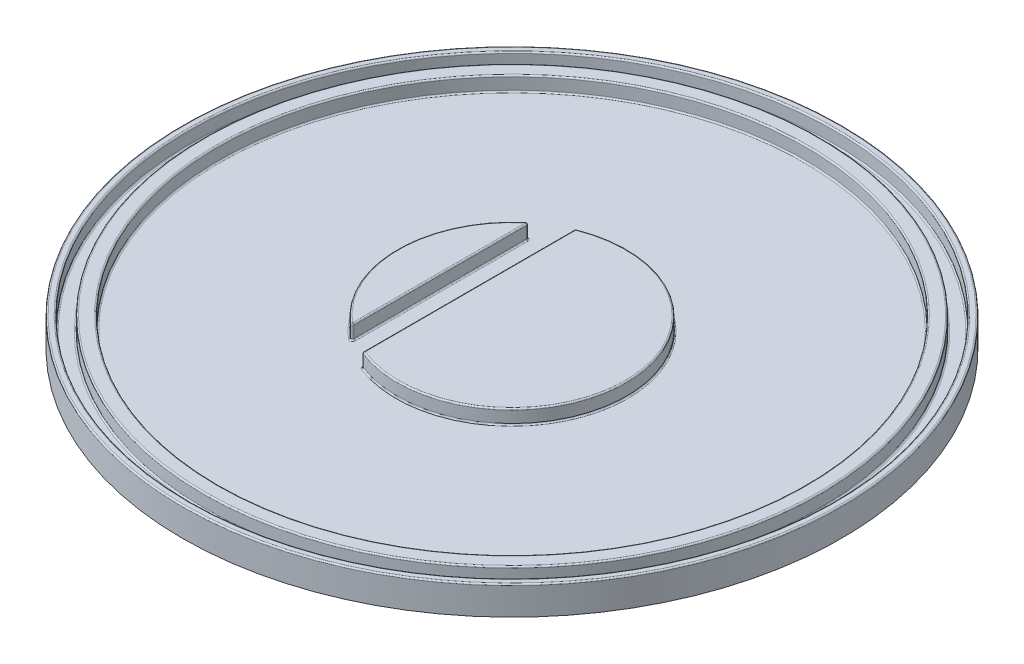
from build123d import *

# Parameters (mm, degrees)
BASES_R                   = 23
BASE_DEPTH                = 1
OUTERRINGPROFILES_R       = 23
OUTERRINGPROFILES_R_2     = 22.5
OUTERRINGPROFILE_DEPTH    = 1
WIREENCAPSULATINGS_R      = 21.5
WIREENCAPSULATINGS_R_2    = 20.5
WIREENCAPSULATINGS_R_3    = 8
WIREENCAPSULATING_DEPTH   = 1
WIREACCESS_START          = -1
WIREACCESS_DEPTH          = 1
WIREENCAPSULATINGFILLET_R = 0.1


with BuildPart() as part:
    # BaseS → Base (new body)
    with BuildSketch(Plane(origin=(0, 0, 0), x_dir=(1, 0, 0), z_dir=(0, 1, 0))):
        with Locations(Location((0, 0, 0), (0, 0, 270))):
            Circle(BASES_R)
    extrude(amount=BASE_DEPTH)

    # OuterRingProfileS → OuterRingProfile (add)
    with BuildSketch(Plane(origin=(0, 1, 0), x_dir=(1, 0, 0), z_dir=(0, 1, 0))):
        with Locations(Location((0, 0, 0), (0, 0, 270))):
            Circle(OUTERRINGPROFILES_R)
        with Locations(Location((0, 0, 0), (0, 0, 270))):
            Circle(OUTERRINGPROFILES_R_2, mode=Mode.SUBTRACT)
    extrude(amount=OUTERRINGPROFILE_DEPTH)

    # WireEncapsulatingS → WireEncapsulating (add)
    # profile 1 of 2: a face of its own
    with BuildSketch(Plane(origin=(0, 1, 0), x_dir=(1, 0, 0), z_dir=(0, 1, 0))):
        with Locations(Location((0, 0, 0), (0, 0, 270))):
            Circle(WIREENCAPSULATINGS_R)
        with Locations(Location((0, 0, 0), (0, 0, 270))):
            Circle(WIREENCAPSULATINGS_R_2, mode=Mode.SUBTRACT)
    # profile 2 of 2: a face of its own
    with BuildSketch(Plane(origin=(0, 1, 0), x_dir=(1, 0, 0), z_dir=(0, 1, 0))):
        with Locations(Location((0, 0, 0), (0, 0, 270))):
            Circle(WIREENCAPSULATINGS_R_3)
    extrude(amount=WIREENCAPSULATING_DEPTH)

    # WireAccessS → WireAccess (cut)
    with BuildSketch(Plane(origin=(0, 2, 0), x_dir=(1, 0, 0), z_dir=(0, 1, 0)).offset(WIREACCESS_START)):
        with BuildLine():
            Line((-5, 6.244997998), (-5, -6.244997998))
            ThreePointArc((-5, -6.244997998), (-4.042638698, -6.903410197), (-3, -7.416198487))
            Line((-3, -7.416198487), (-3, 7.416198487))
            ThreePointArc((-3, 7.416198487), (-4.042638698, 6.903410197), (-5, 6.244997998))
        make_face()
    extrude(amount=WIREACCESS_DEPTH, mode=Mode.SUBTRACT)

    # WireEncapsulatingFillet
    wireencapsulatingfillet_edges = [part.edges().sort_by_distance(p)[0] for p in [
        (0, 1, -20.5),
        (0, 2, -20.5),
        (0, 1, -21.5),
        (0, 2, -21.5),
        (-8, 1, 0),
        (8, 1, 0),
        (-8, 2, 0),
        (8, 2, 0),
        (-5, 1.5, -6.244997998),
        (-3, 1.5, -7.416198487),
        (-3, 1.5, 7.416198487),
        (-5, 1.5, 6.244997998),
        (-5, 2, 0),
        (-3, 2, 0),
        (-3, 1, 0),
        (-5, 1, 0),
        (0, 1, -22.5),
        (0, 2, -23),
        (0, 2, -22.5),
    ]]
    fillet(wireencapsulatingfillet_edges, radius=WIREENCAPSULATINGFILLET_R)


solid = part.part
